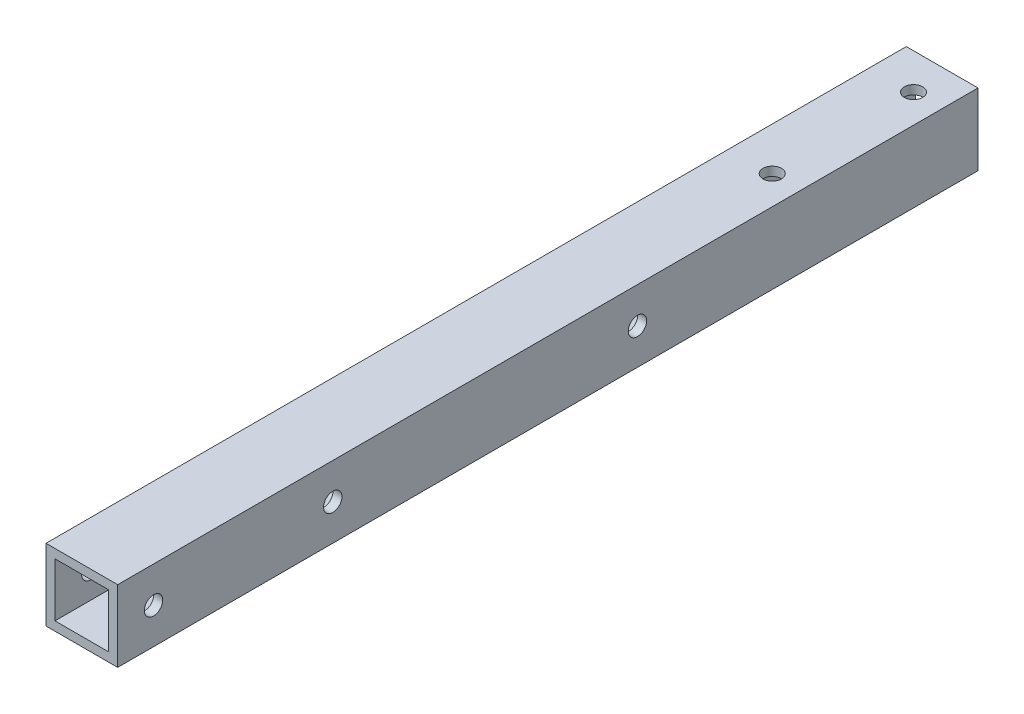
from build123d import *

# Parameters (mm, degrees)
SKETCH2_W           = 25.4
SKETCH2_H           = 25.4
BOSS_EXTRUDE1_DEPTH = 304.8
SKETCH4_W           = 19.05
SKETCH4_H           = 19.05
CUT_EXTRUDE1_DEPTH  = 306.328708116
SKETCH5_R           = 3.2639
CUT_EXTRUDE2_DEPTH  = 304.8
SKETCH6_R           = 3.2639
CUT_EXTRUDE3_DEPTH  = 304.8
SKETCH8_R           = 3.2639
CUT_EXTRUDE5_DEPTH  = 307.120058147
SKETCH9_R           = 3.2639
CUT_EXTRUDE6_DEPTH  = 307.120058147
SKETCH10_R          = 3.2639
CUT_EXTRUDE7_DEPTH  = 307.120058147


with BuildPart() as part:
    # Sketch2 → Boss-Extrude1 (new body)
    with BuildSketch(Plane.XY):
        Rectangle(SKETCH2_W, SKETCH2_H)
    extrude(amount=BOSS_EXTRUDE1_DEPTH)

    # Sketch4 → Cut-Extrude1 (cut, through all)
    with BuildSketch(Plane.XY):
        Rectangle(SKETCH4_W, SKETCH4_H)
    extrude(amount=CUT_EXTRUDE1_DEPTH, mode=Mode.SUBTRACT)

    # Sketch5 → Cut-Extrude2 (cut)
    with BuildSketch(Plane(origin=(0, 12.7, 0), x_dir=(1, 0, 0), z_dir=(0, 1, 0))):
        with Locations(Location((2.54, -12.7, 0), (0, 0, 270))):
            Circle(SKETCH5_R)
    extrude(amount=-CUT_EXTRUDE2_DEPTH, mode=Mode.SUBTRACT)

    # Sketch6 → Cut-Extrude3 (cut)
    with BuildSketch(Plane(origin=(0, 12.7, 0), x_dir=(1, 0, 0), z_dir=(0, 1, 0))):
        with Locations(Location((2.54, -62.738, 0), (0, 0, 270))):
            Circle(SKETCH6_R)
    extrude(amount=-CUT_EXTRUDE3_DEPTH, mode=Mode.SUBTRACT)

    # Sketch8 → Cut-Extrude5 (cut, through all)
    with BuildSketch(Plane.ZY.offset(12.7)):
        with Locations((292.1, 0)):
            Circle(SKETCH8_R)
    extrude(amount=-CUT_EXTRUDE5_DEPTH, mode=Mode.SUBTRACT)

    # Sketch9 → Cut-Extrude6 (cut, through all)
    with BuildSketch(Plane(origin=(12.7, 0, 0), x_dir=(0, 0, -1), z_dir=(1, 0, 0))):
        with Locations((-228.6, 0)):
            Circle(SKETCH9_R)
    extrude(amount=-CUT_EXTRUDE6_DEPTH, mode=Mode.SUBTRACT)

    # Sketch10 → Cut-Extrude7 (cut, through all)
    with BuildSketch(Plane.ZY.offset(12.7)):
        with Locations((120.65, 0)):
            Circle(SKETCH10_R)
    extrude(amount=-CUT_EXTRUDE7_DEPTH, mode=Mode.SUBTRACT)


solid = part.part
